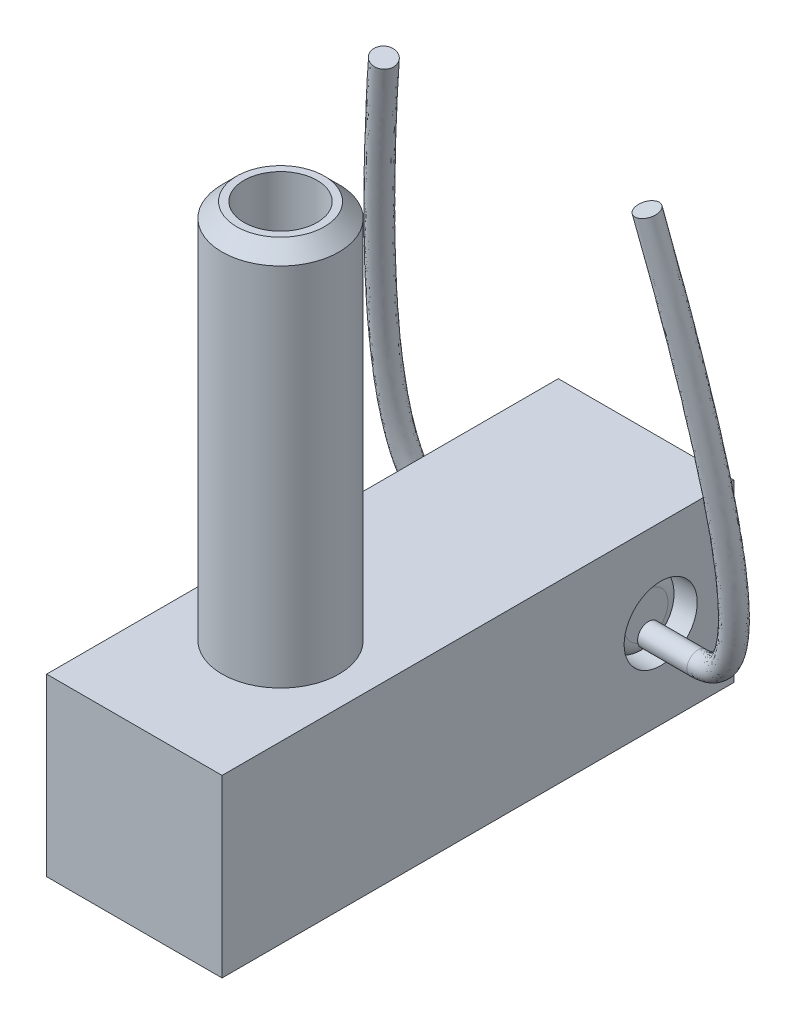
from build123d import *

# Parameters (mm, degrees)
SKIZZE1_W                       = 12
SKIZZE1_H                       = 12
AUFSATZ_LINEAR_AUSTRAGEN1_DEPTH = 35
SKIZZE2_R                       = 2.5
SCHNITT_LINEAR_AUSTRAGEN1_DEPTH = 35
M8_GEWINDEBOHRUNG1_D            = 6.8
FASE1_SIZE                      = 3
VERRUNDUNG2_R                   = 1
SKIZZE8_R                       = 4
SKIZZE8_R_2                     = 2.5
AUFSATZ_LINEAR_AUSTRAGEN2_DEPTH = 30
FASE2_SIZE                      = 1
SKIZZE9_R                       = 2.5
AUFSATZ_LINEAR_AUSTRAGEN3_DEPTH = 5
VERRUNDUNG3_R                   = 1
SKIZZE11_R                      = 0.75


with BuildPart() as part:
    # Skizze1 → Aufsatz-Linear austragen1 (new body)
    with BuildSketch(Plane.XY):
        Rectangle(SKIZZE1_W, SKIZZE1_H)
    extrude(amount=AUFSATZ_LINEAR_AUSTRAGEN1_DEPTH)

    # Skizze2 → Schnitt-Linear austragen1 (cut)
    with BuildSketch(Plane.ZY.offset(6)):
        with Locations((5, 0)):
            Circle(SKIZZE2_R)
    extrude(amount=-SCHNITT_LINEAR_AUSTRAGEN1_DEPTH, mode=Mode.SUBTRACT)

    # M8 Gewindebohrung1 (through all)
    with Locations(Plane(origin=(0, 6, 0), x_dir=(-1, 0, 0), z_dir=(0, 1, 0))):
        with Locations((0, 25)):
            Hole(M8_GEWINDEBOHRUNG1_D / 2)


with BuildPart() as body_2:
    # Skizze7 → Rotation1 (revolve)
    with BuildSketch(Plane(origin=(0, 0, 0), x_dir=(0, 0, -1), z_dir=(1, 0, 0))):
        Polygon((-29, 2), (-26.5, 2), (-26.5, -8.5), (-25.25, -8.5), (-25.25, -10), (-29, -10), align=None)
    revolve(axis=Axis((0, 2, 25), (0, -1, 0)))

    # Fase1
    fase1_edges = [body_2.edges().sort_by_distance(p)[0] for p in [
        (0, -10, 21),
    ]]
    chamfer(fase1_edges, length=FASE1_SIZE)

    # Verrundung2
    verrundung2_edges = [body_2.edges().sort_by_distance(p)[0] for p in [
        (0, -7, 21),
    ]]
    fillet(verrundung2_edges, radius=VERRUNDUNG2_R)


with BuildPart() as body_3:
    # Skizze8 → Aufsatz-Linear austragen2 (new body)
    with BuildSketch(Plane(origin=(0, 2, 0), x_dir=(1, 0, 0), z_dir=(0, 1, 0))):
        with Locations((0, -25)):
            Circle(SKIZZE8_R)
        with Locations((0, -25)):
            Circle(SKIZZE8_R_2, mode=Mode.SUBTRACT)
    extrude(amount=AUFSATZ_LINEAR_AUSTRAGEN2_DEPTH)

    # Fase2
    fase2_edges = [body_3.edges().sort_by_distance(p)[0] for p in [
        (-4, 2, 25),
        (-4, 32, 25),
    ]]
    chamfer(fase2_edges, length=FASE2_SIZE)


with BuildPart() as body_4:
    # Skizze9 → Aufsatz-Linear austragen3 (new, symmetric)
    with BuildSketch(Plane(origin=(0, 0, 0), x_dir=(0, 0, -1), z_dir=(1, 0, 0))):
        with Locations((-5, 0)):
            Circle(SKIZZE9_R)
    extrude(amount=AUFSATZ_LINEAR_AUSTRAGEN3_DEPTH, both=True)

    # Verrundung3
    verrundung3_edges = [body_4.edges().sort_by_distance(p)[0] for p in [
        (5, 0, 7.5),
        (-5, 0, 7.5),
    ]]
    fillet(verrundung3_edges, radius=VERRUNDUNG3_R)

    # Austragung1: sweep along a path in Skizze10
    with BuildLine() as austragung1_path:  # in the path sketch's own coordinates; laid on its plane below (add() does not lay a ready-made edge on the line's plane)
        add(Edge.make_bspline(
            [(9.0031118, 28.952922174), (14.661016366, -0.530624786), (8.3744964, -0.530624786)],
            knots=[0, 0, 0, 1, 1, 1], degree=2))
        Line((8.3744964, -0.530624786), (-8.3744964, -0.530624786))
        add(Edge.make_bspline(
            [(-8.3744964, -0.530624786), (-14.661016366, -0.530624786), (-9.0031118, 28.952922174)],
            knots=[0, 0, 0, 1, 1, 1], degree=2))
    # Skizze11 → Austragung1 (sweep)
    with BuildSketch(Plane(origin=(9.0031118, 27.982060936, 8.932622201), x_dir=(-0.980384779209946, -0.17813021392733064, -0.08435230630912684), z_dir=(-0.1884616539074955, 0.9725230087492234, 0.13667919541689408))):
        Circle(SKIZZE11_R)
    sweep(path=Plane(origin=(0, -0.68909339, 4.90315424), x_dir=(-1, 0, 0), z_dir=(0, 0.1391731009600624, -0.9902680687415708)) * austragung1_path.line)


solid = Compound([part.part, body_2.part, body_3.part, body_4.part])
